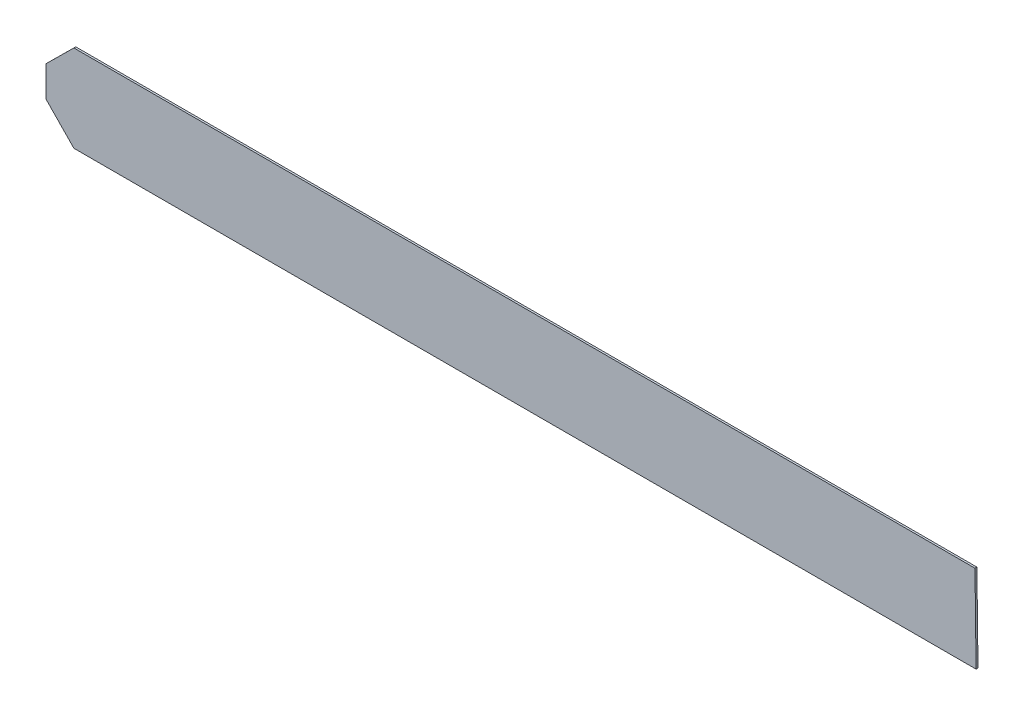
from build123d import *

# Parameters (mm, degrees)
BOSS_EXTRUDE1_DEPTH = 9.525


with BuildPart() as part:
    # Sketch1 → Boss-Extrude1 (new body)
    with BuildSketch(Plane.XY):
        Polygon((4266.811739053, -146.790318846), (-216.488062196, -146.790318846), (-354.995654443, -4.562065129), (-354.995654443, 147.837934871), (-216.488062196, 285.009681154), (4261.316220756, 285.009681154), align=None)
    extrude(amount=BOSS_EXTRUDE1_DEPTH)


solid = part.part
